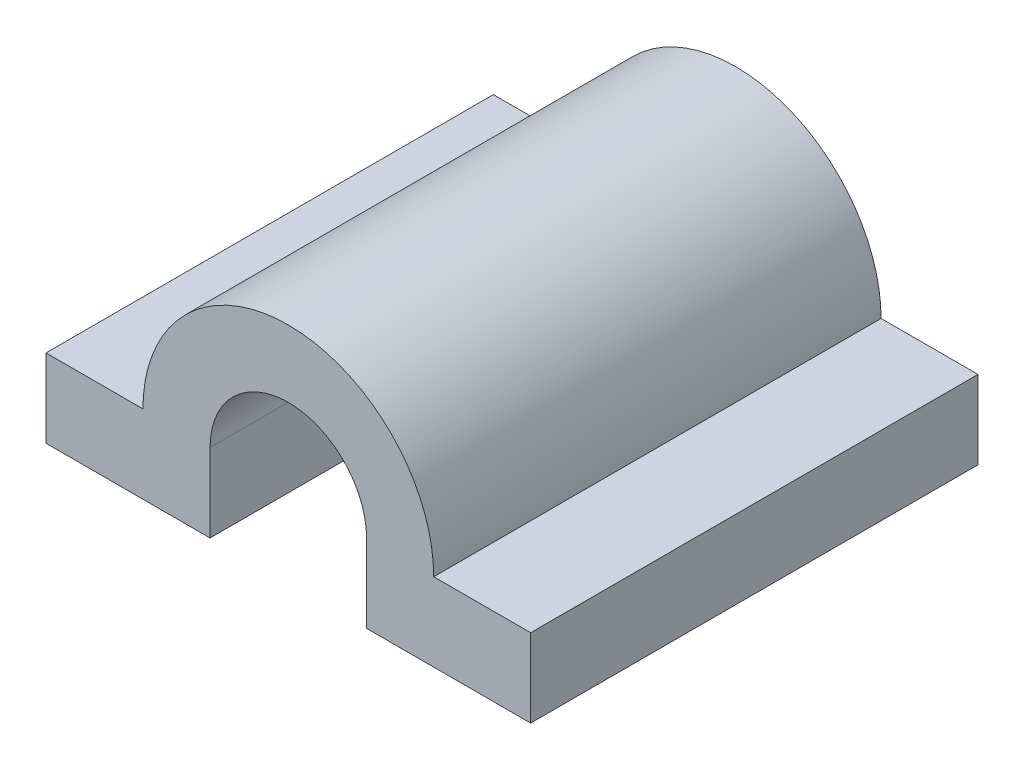
from build123d import *

# Parameters (mm, degrees)
BOSS_EXTRUDE1_DEPTH = 12


with BuildPart() as part:
    # Sketch1 → Boss-Extrude1 (new body)
    with BuildSketch(Plane.XY):
        with BuildLine():
            Line((-2.1, 0), (-2.1, -2.1))
            Line((-2.1, -2.1), (-6.5, -2.1))
            Line((-6.5, -2.1), (-6.5, 0))
            Line((-6.5, 0), (-3.9, 0))
            ThreePointArc((-3.9, 0), (0, 3.9), (3.9, 0))
            Line((3.9, 0), (6.5, 0))
            Line((6.5, 0), (6.5, -2.1))
            Line((6.5, -2.1), (2.1, -2.1))
            Line((2.1, -2.1), (2.1, 0))
            ThreePointArc((2.1, 0), (0, 2.1), (-2.1, 0))
        make_face()
    extrude(amount=BOSS_EXTRUDE1_DEPTH)


solid = part.part
